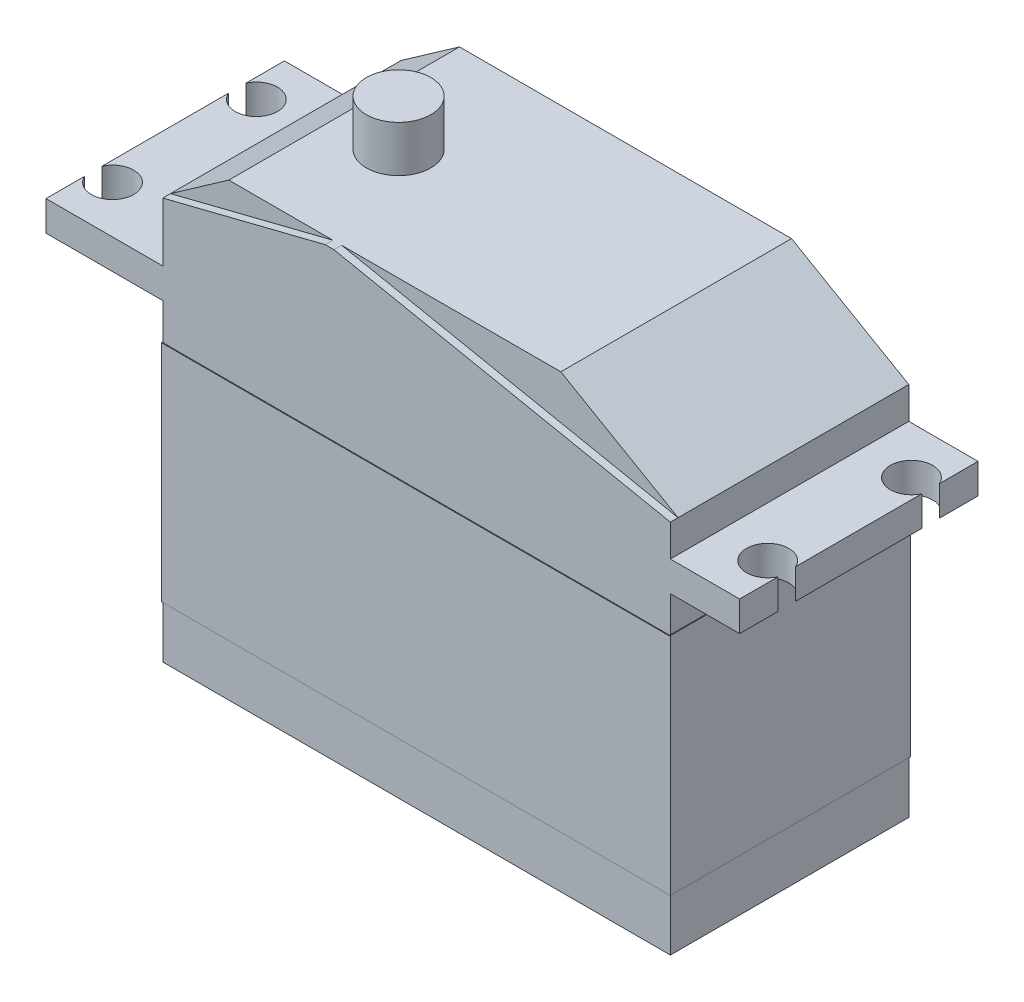
from build123d import *

# Parameters (mm, degrees)
SKETCH2_W            = 66
SKETCH2_H            = 31
BOSS_EXTRUDE1_DEPTH  = 44.6
SKETCH4_W            = 31
SKETCH4_H            = 3.9
BOSS_EXTRUDE2_DEPTH  = 9
SKETCH6_R            = 2.75
CUT_EXTRUDE3_DEPTH   = 64.193433203
BOSS_EXTRUDE4_DEPTH  = 3.9
SKETCH8_W            = 66
SKETCH8_H            = 31
BOSS_EXTRUDE5_DEPTH  = 12.96
CUT_EXTRUDE7_DEPTH   = 82.21610038
CUT_EXTRUDE8_DEPTH   = 82.21610038
CUT_EXTRUDE9_DEPTH   = 1
SKETCH12_R           = 4.19
BOSS_EXTRUDE6_DEPTH  = 6
SKETCH13_W           = 66
SKETCH13_H           = 29.265979079
BOSS_EXTRUDE7_DEPTH  = 0.1
SKETCH14_W           = 31.1
SKETCH14_H           = 29.164669929
BOSS_EXTRUDE8_DEPTH  = 0.1
SKETCH15_W           = 66.1
SKETCH15_H           = 29.164669929
BOSS_EXTRUDE9_DEPTH  = 0.1
SKETCH16_W           = 31.2
SKETCH16_H           = 29.265979079
BOSS_EXTRUDE10_DEPTH = 0.1


with BuildPart() as part:
    # Sketch2 → Boss-Extrude1 (new body)
    with BuildSketch(Plane(origin=(0, 0, 0), x_dir=(1, 0, 0), z_dir=(0, 1, 0))):
        Rectangle(SKETCH2_W, SKETCH2_H)
    extrude(amount=BOSS_EXTRUDE1_DEPTH)

    # Sketch4 → Boss-Extrude2 (add)
    with BuildSketch(Plane(origin=(33, 0, 0), x_dir=(0, 0, -1), z_dir=(1, 0, 0))):
        with Locations((0, 42.65)):
            Rectangle(SKETCH4_W, SKETCH4_H)
    extrude(amount=BOSS_EXTRUDE2_DEPTH)

    # Sketch6 → Cut-Extrude3 (cut, through all)
    with BuildSketch(Plane(origin=(0, 44.6, 0), x_dir=(1, 0, 0), z_dir=(0, 1, 0))):
        with Locations((39.5, -9.35)):
            Circle(SKETCH6_R)
        with Locations((39.5, 9.35)):
            Circle(SKETCH6_R)
    extrude(amount=-CUT_EXTRUDE3_DEPTH, mode=Mode.SUBTRACT)

    # Sketch7 → Boss-Extrude4 (add)
    with BuildSketch(Plane(origin=(0, 44.6, 0), x_dir=(1, 0, 0), z_dir=(0, 1, 0))):
        with BuildLine():
            Line((-33, 15.5), (-48.186111703, 15.5))
            Line((-48.186111703, 15.5), (-48.186111703, 10.495643924))
            ThreePointArc((-48.186111703, 10.495643924), (-42.936111703, 9.35), (-48.186111703, 8.204356076))
            Line((-48.186111703, 8.204356076), (-48.186111703, -8.204356076))
            ThreePointArc((-48.186111703, -8.204356076), (-42.936111703, -9.35), (-48.186111703, -10.495643924))
            Line((-48.186111703, -10.495643924), (-48.186111703, -15.5))
            Line((-48.186111703, -15.5), (-33, -15.5))
            Line((-33, -15.5), (-33, 15.5))
        make_face()
    extrude(amount=-BOSS_EXTRUDE4_DEPTH)

    # Sketch8 → Boss-Extrude5 (add)
    with BuildSketch(Plane(origin=(0, 44.6, 0), x_dir=(1, 0, 0), z_dir=(0, 1, 0))):
        Rectangle(SKETCH8_W, SKETCH8_H)
    extrude(amount=BOSS_EXTRUDE5_DEPTH)

    # Sketch9 → Cut-Extrude7 (cut, through all)
    with BuildSketch(Plane.XY.offset(15.5)):
        Polygon((-25.417976584, 57.56), (-33, 52.251010049), (-33, 57.56), align=None)
    extrude(amount=-CUT_EXTRUDE7_DEPTH, mode=Mode.SUBTRACT)

    # Sketch10 → Cut-Extrude8 (cut, through all)
    with BuildSketch(Plane.XY.offset(15.5)):
        Polygon((17.751890933, 57.56), (33, 48.756500125), (33, 57.56), align=None)
    extrude(amount=-CUT_EXTRUDE8_DEPTH, mode=Mode.SUBTRACT)

    # Sketch11 → Cut-Extrude9 (cut)
    with BuildSketch(Plane.XY.offset(15.5)):
        Polygon((-33, 52.251010049), (-11.889467425, 57.56), (-25.417976584, 57.56), align=None)
        Polygon((33, 48.756500125), (-10.755426907, 57.56), (17.751890933, 57.56), align=None)
    extrude(amount=-CUT_EXTRUDE9_DEPTH, mode=Mode.SUBTRACT)

    # Sketch12 → Boss-Extrude6 (add)
    with BuildSketch(Plane(origin=(0, 57.56, 0), x_dir=(1, 0, 0), z_dir=(0, 1, 0))):
        with Locations(Location((-17.839262747, 0, 0), (0, 0, 270))):
            Circle(SKETCH12_R)
    extrude(amount=BOSS_EXTRUDE6_DEPTH)

    # Sketch13 → Boss-Extrude7 (add)
    with BuildSketch(Plane(origin=(0, 0, -15.5), x_dir=(-1, 0, 0), z_dir=(0, 0, -1))):
        with Locations((0, 21.440452746)):
            Rectangle(SKETCH13_W, SKETCH13_H)
    extrude(amount=BOSS_EXTRUDE7_DEPTH)

    # Sketch14 → Boss-Extrude8 (add)
    with BuildSketch(Plane.ZY.offset(33)):
        with Locations((-0.05, 21.389798171)):
            Rectangle(SKETCH14_W, SKETCH14_H)
    extrude(amount=BOSS_EXTRUDE8_DEPTH)

    # Sketch15 → Boss-Extrude9 (add)
    with BuildSketch(Plane.XY.offset(15.5)):
        with Locations((-0.05, 21.389798171)):
            Rectangle(SKETCH15_W, SKETCH15_H)
    extrude(amount=BOSS_EXTRUDE9_DEPTH)

    # Sketch16 → Boss-Extrude10 (add)
    with BuildSketch(Plane(origin=(33, 0, 0), x_dir=(0, 0, -1), z_dir=(1, 0, 0))):
        with Locations((0, 21.440452746)):
            Rectangle(SKETCH16_W, SKETCH16_H)
    extrude(amount=BOSS_EXTRUDE10_DEPTH)


solid = part.part
